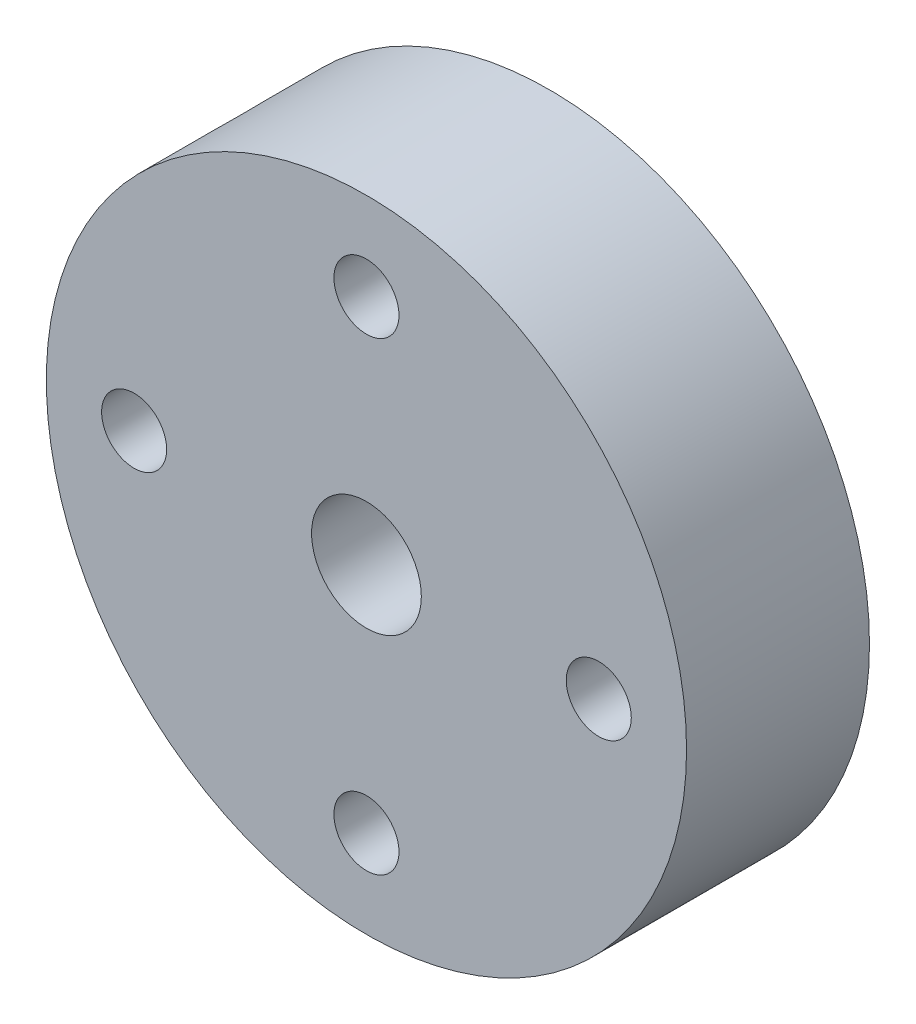
from build123d import *

# Parameters (mm, degrees)
SKETCH1_R                 = 8.75
SKETCH1_R_2               = 1.5
BOSS_EXTRUDE1_DEPTH       = 5
F_2_56_TAPPED_HOLE1_D     = 1.778
F_4_40_TAPPED_HOLE1_D     = 2.2606
F_4_40_TAPPED_HOLE1_DEPTH = 7.62
F_4_40_TAPPED_HOLE1_TIP   = 0.679152758


with BuildPart() as part:
    # Sketch1 → Boss-Extrude1 (new body)
    with BuildSketch(Plane.XY):
        Circle(SKETCH1_R)
        Circle(SKETCH1_R_2, mode=Mode.SUBTRACT)
    extrude(amount=BOSS_EXTRUDE1_DEPTH)

    # #2-56 Tapped Hole1 (through all)
    with Locations(Plane.XY.offset(5)):
        with Locations((-6.35, 0), (0, 6.35), (6.35, 0), (0, -6.35)):
            Hole(F_2_56_TAPPED_HOLE1_D / 2)

    # #4-40 Tapped Hole1
    with Locations(Plane(origin=(-6.759669176, 5.556021295, 2.40860038), x_dir=(-0.634973862285, -0.772533620119, 0), z_dir=(-0.772533620119, 0.634973862285, 0))):
        with Locations((0, 0)):
            Hole(F_4_40_TAPPED_HOLE1_D / 2, depth=F_4_40_TAPPED_HOLE1_DEPTH)
            with Locations((0, 0, -(F_4_40_TAPPED_HOLE1_DEPTH + F_4_40_TAPPED_HOLE1_TIP / 2))):  # 118° drill point
                Cone(0, F_4_40_TAPPED_HOLE1_D / 2, F_4_40_TAPPED_HOLE1_TIP, mode=Mode.SUBTRACT)


solid = part.part
